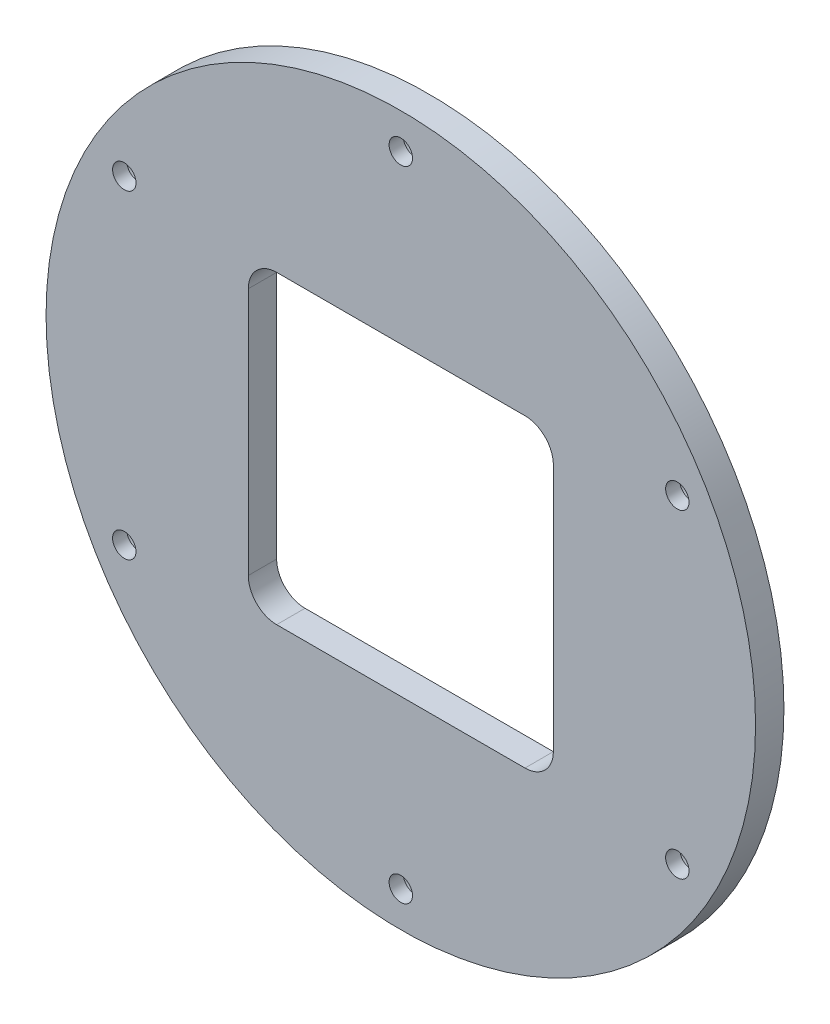
from build123d import *

# Parameters (mm, degrees)
SKETCH_1_R          = 50
SKETCH_1_R_2        = 1.65
SKETCH_1_W          = 43
SKETCH_1_H          = 43
EXTRUDE_1_DEPTH     = 4
SKETCH_2_R          = 3.15
CUT_EXTRUDE_1_DEPTH = 2
FILLET_1_R          = 4


with BuildPart() as part:
    # 草图1 → 凸台-拉伸1 (new body)
    with BuildSketch(Plane.XY):
        Circle(SKETCH_1_R)
        with Locations((-38.97114317, 22.5)):
            Circle(SKETCH_1_R_2, mode=Mode.SUBTRACT)
        with Locations((0, 45)):
            Circle(SKETCH_1_R_2, mode=Mode.SUBTRACT)
        with Locations((38.97114317, 22.5)):
            Circle(SKETCH_1_R_2, mode=Mode.SUBTRACT)
        with Locations((38.97114317, -22.5)):
            Circle(SKETCH_1_R_2, mode=Mode.SUBTRACT)
        with Locations((0, -45)):
            Circle(SKETCH_1_R_2, mode=Mode.SUBTRACT)
        with Locations((-38.97114317, -22.5)):
            Circle(SKETCH_1_R_2, mode=Mode.SUBTRACT)
        Rectangle(SKETCH_1_W, SKETCH_1_H, mode=Mode.SUBTRACT)
    extrude(amount=EXTRUDE_1_DEPTH)

    # 草图2 → 切除-拉伸1 (cut)
    with BuildSketch(Plane.XY):
        with Locations((0, 45)):
            Circle(SKETCH_2_R)
        with Locations((38.97114317, 22.5)):
            Circle(SKETCH_2_R)
        with Locations((38.97114317, -22.5)):
            Circle(SKETCH_2_R)
        with Locations((0, -45)):
            Circle(SKETCH_2_R)
        with Locations((-38.97114317, -22.5)):
            Circle(SKETCH_2_R)
        with Locations((-38.97114317, 22.5)):
            Circle(SKETCH_2_R)
    extrude(amount=CUT_EXTRUDE_1_DEPTH, mode=Mode.SUBTRACT)

    # 圆角1
    fillet_1_edges = [part.edges().sort_by_distance(p)[0] for p in [
        (21.5, -21.5, 2),
        (21.5, 21.5, 2),
        (-21.5, 21.5, 2),
        (-21.5, -21.5, 2),
    ]]
    fillet(fillet_1_edges, radius=FILLET_1_R)


solid = part.part
